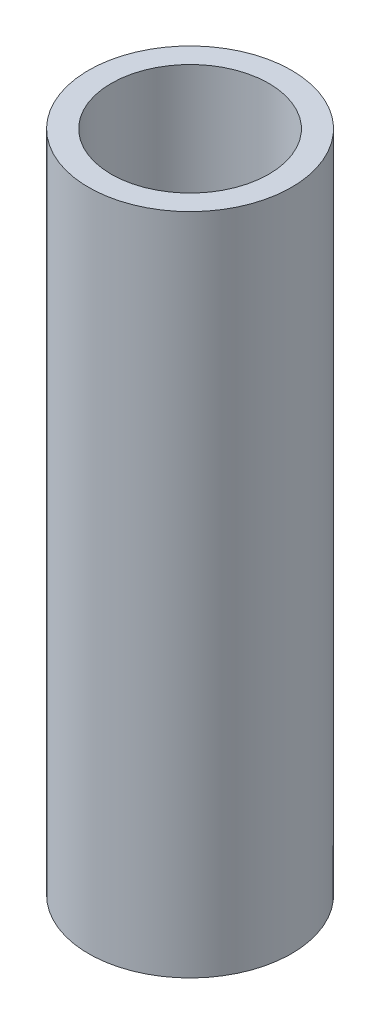
from build123d import *

# Parameters (mm, degrees)
SKETCH1_R           = 3.9751
SKETCH1_R_2         = 3.0861
BOSS_EXTRUDE1_DEPTH = 13


with BuildPart() as part:
    # Sketch1 → Boss-Extrude1 (new, symmetric)
    with BuildSketch(Plane(origin=(0, 0, 0), x_dir=(1, 0, 0), z_dir=(0, 1, 0))):
        with Locations(Location((0, 0, 0), (0, 0, 90))):
            Circle(SKETCH1_R)
        with Locations(Location((0, 0, 0), (0, 0, 90))):
            Circle(SKETCH1_R_2, mode=Mode.SUBTRACT)
    extrude(amount=BOSS_EXTRUDE1_DEPTH, both=True)


solid = part.part
